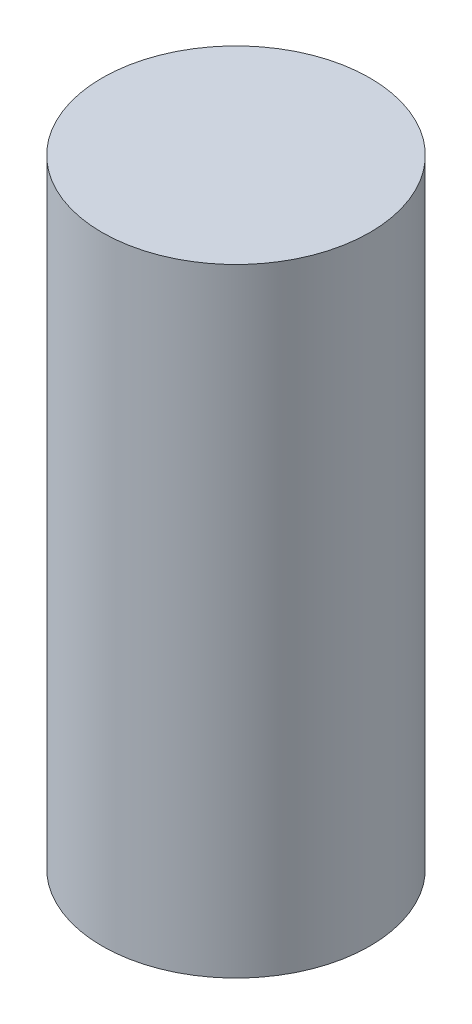
from build123d import *

# Parameters (mm, degrees)
SKETCH1_R           = 32.5
BOSS_EXTRUDE1_DEPTH = 150


with BuildPart() as part:
    # Sketch1 → Boss-Extrude1 (new body)
    with BuildSketch(Plane(origin=(0, 0, 0), x_dir=(1, 0, 0), z_dir=(0, 1, 0))):
        with Locations(Location((0, 0, 0), (0, 0, 270))):
            Circle(SKETCH1_R)
    extrude(amount=BOSS_EXTRUDE1_DEPTH)


solid = part.part
